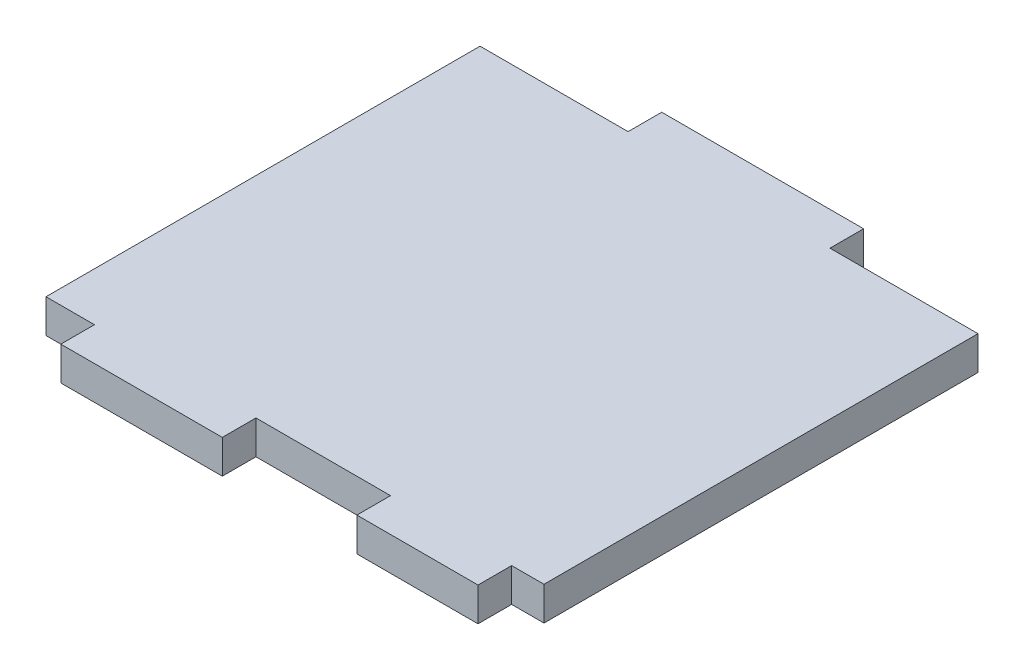
from build123d import *

# Parameters (mm, degrees)
BOSS_EXTRUDE1_DEPTH = 3.175


with BuildPart() as part:
    # Sketch2 → Boss-Extrude1 (new body)
    with BuildSketch(Plane(origin=(0, 0, 0), x_dir=(1, 0, 0), z_dir=(0, 1, 0))):
        Polygon((0, 0), (4.572, 0), (4.572, -3.175), (19.812, -3.175), (19.812, 0), (32.512, 0), (32.512, -3.175), (43.942, -3.175), (43.942, 0), (46.993048, 0), (46.993048, 40.9575), (33.021524, 40.9575), (33.021524, 44.1325), (13.971524, 44.1325), (13.971524, 40.9575), (0, 40.9575), align=None)
    extrude(amount=BOSS_EXTRUDE1_DEPTH)


solid = part.part
